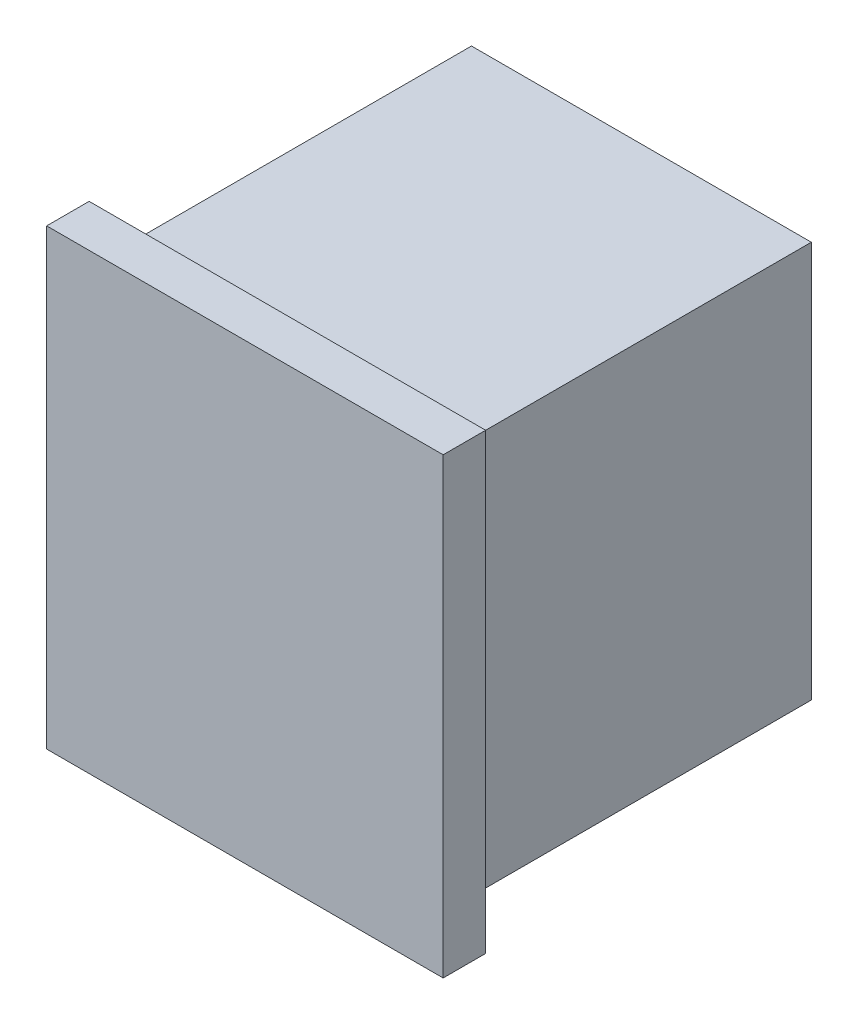
from build123d import *

# Parameters (mm, degrees)
SKETCH_1_W      = 28
SKETCH_1_H      = 32
EXTRUDE_1_DEPTH = 3
SKETCH_2_W      = 24
SKETCH_2_H      = 28
EXTRUDE_2_DEPTH = 25


with BuildPart() as part:
    # Эскиз1 → Бобышка-Вытянуть1 (new body)
    with BuildSketch(Plane.XY):
        Rectangle(SKETCH_1_W, SKETCH_1_H)
    extrude(amount=EXTRUDE_1_DEPTH)

    # Эскиз2 → Бобышка-Вытянуть2 (add)
    with BuildSketch(Plane(origin=(0, 0, 0), x_dir=(-1, 0, 0), z_dir=(0, 0, -1))):
        Rectangle(SKETCH_2_W, SKETCH_2_H)
    extrude(amount=EXTRUDE_2_DEPTH)


solid = part.part
